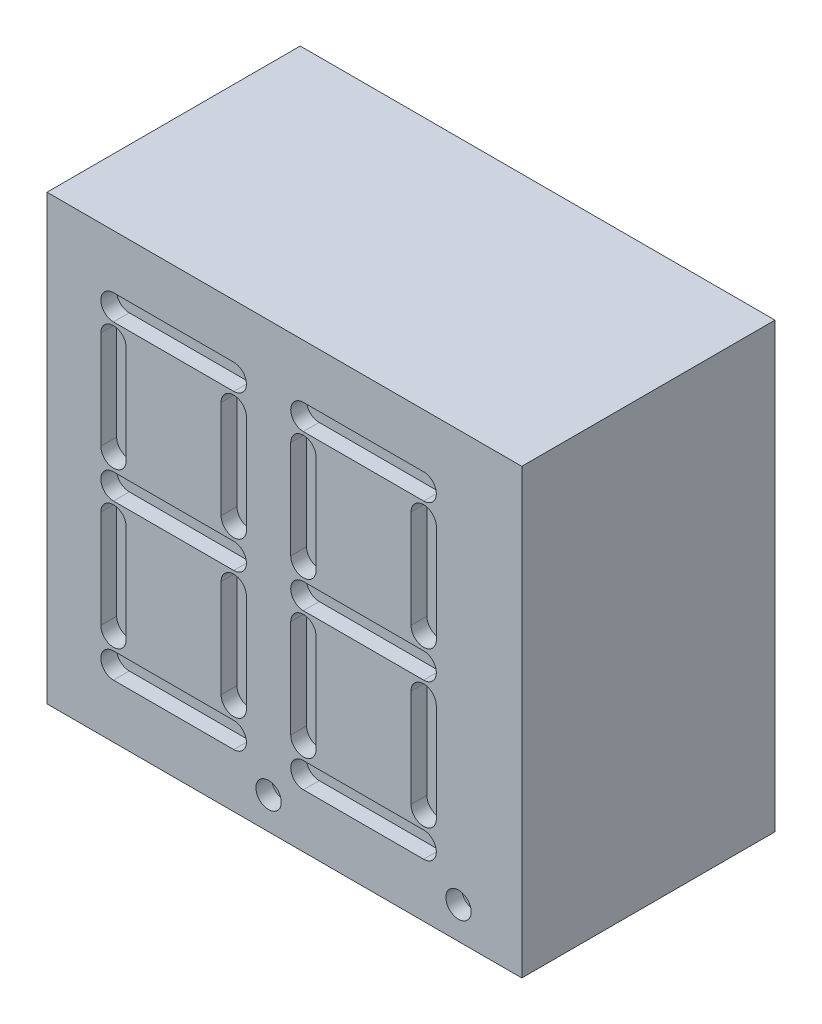
from build123d import *

# Parameters (mm, degrees)
SKETCH_1_W          = 15
SKETCH_1_H          = 14
EXTRUDE_1_DEPTH     = 8
SKETCH_2_R          = 0.4
CUT_EXTRUDE_1_DEPTH = 0.5


with BuildPart() as part:
    # 草图1 → 凸台-拉伸1 (new body)
    with BuildSketch(Plane.XY):
        Rectangle(SKETCH_1_W, SKETCH_1_H)
    extrude(amount=EXTRUDE_1_DEPTH)

    # 草图2 → 切除-拉伸1 (cut)
    with BuildSketch(Plane.XY.offset(8)):
        with Locations((-0.5, -5.99218047)):
            Circle(SKETCH_2_R)
        with Locations((5.5, -5.99218047)):
            Circle(SKETCH_2_R)
        with BuildLine():
            Line((-5.4, 5.3), (-1.6, 5.3))
            ThreePointArc((-1.6, 5.3), (-1.2, 4.9), (-1.6, 4.5))
            Line((-1.6, 4.5), (-5.4, 4.5))
            ThreePointArc((-5.4, 4.5), (-5.8, 4.9), (-5.4, 5.3))
        make_face()
        with BuildLine():
            Line((-5.4, -5.3), (-1.6, -5.3))
            ThreePointArc((-1.6, -5.3), (-1.2, -4.9), (-1.6, -4.5))
            Line((-1.6, -4.5), (-5.4, -4.5))
            ThreePointArc((-5.4, -4.5), (-5.8, -4.9), (-5.4, -5.3))
        make_face()
        with BuildLine():
            Line((-5.8, 4), (-5.8, 0.9))
            ThreePointArc((-5.8, 0.9), (-5.4, 0.5), (-5, 0.9))
            Line((-5, 0.9), (-5, 4))
            ThreePointArc((-5, 4), (-5.4, 4.4), (-5.8, 4))
        make_face()
        with BuildLine():
            Line((-2, 4), (-2, 0.9))
            ThreePointArc((-2, 0.9), (-1.6, 0.5), (-1.2, 0.9))
            Line((-1.2, 0.9), (-1.2, 4))
            ThreePointArc((-1.2, 4), (-1.6, 4.4), (-2, 4))
        make_face()
        with BuildLine():
            Line((-1.2, -4), (-1.2, -0.9))
            ThreePointArc((-1.2, -0.9), (-1.6, -0.5), (-2, -0.9))
            Line((-2, -0.9), (-2, -4))
            ThreePointArc((-2, -4), (-1.6, -4.4), (-1.2, -4))
        make_face()
        with BuildLine():
            Line((-5.8, -4), (-5.8, -0.9))
            ThreePointArc((-5.8, -0.9), (-5.4, -0.5), (-5, -0.9))
            Line((-5, -0.9), (-5, -4))
            ThreePointArc((-5, -4), (-5.4, -4.4), (-5.8, -4))
        make_face()
        with BuildLine():
            Line((-5.4, 0.4), (-1.6, 0.4))
            ThreePointArc((-1.6, 0.4), (-1.2, 0), (-1.6, -0.4))
            Line((-1.6, -0.4), (-5.4, -0.4))
            ThreePointArc((-5.4, -0.4), (-5.8, 0), (-5.4, 0.4))
        make_face()
        with BuildLine():
            Line((4.4, -5.3), (0.6, -5.3))
            ThreePointArc((0.6, -5.3), (0.2, -4.9), (0.6, -4.5))
            Line((0.6, -4.5), (4.4, -4.5))
            ThreePointArc((4.4, -4.5), (4.8, -4.9), (4.4, -5.3))
        make_face()
        with BuildLine():
            Line((0.2, -4), (0.2, -0.9))
            ThreePointArc((0.2, -0.9), (0.6, -0.5), (1, -0.9))
            Line((1, -0.9), (1, -4))
            ThreePointArc((1, -4), (0.6, -4.4), (0.2, -4))
        make_face()
        with BuildLine():
            Line((4, -4), (4, -0.9))
            ThreePointArc((4, -0.9), (4.4, -0.5), (4.8, -0.9))
            Line((4.8, -0.9), (4.8, -4))
            ThreePointArc((4.8, -4), (4.4, -4.4), (4, -4))
        make_face()
        with BuildLine():
            Line((4.4, -0.4), (0.6, -0.4))
            ThreePointArc((0.6, -0.4), (0.2, 0), (0.6, 0.4))
            Line((0.6, 0.4), (4.4, 0.4))
            ThreePointArc((4.4, 0.4), (4.8, 0), (4.4, -0.4))
        make_face()
        with BuildLine():
            Line((0.2, 4), (0.2, 0.9))
            ThreePointArc((0.2, 0.9), (0.6, 0.5), (1, 0.9))
            Line((1, 0.9), (1, 4))
            ThreePointArc((1, 4), (0.6, 4.4), (0.2, 4))
        make_face()
        with BuildLine():
            Line((4.4, 4.5), (0.6, 4.5))
            ThreePointArc((0.6, 4.5), (0.2, 4.9), (0.6, 5.3))
            Line((0.6, 5.3), (4.4, 5.3))
            ThreePointArc((4.4, 5.3), (4.8, 4.9), (4.4, 4.5))
        make_face()
        with BuildLine():
            Line((4, 4), (4, 0.9))
            ThreePointArc((4, 0.9), (4.4, 0.5), (4.8, 0.9))
            Line((4.8, 0.9), (4.8, 4))
            ThreePointArc((4.8, 4), (4.4, 4.4), (4, 4))
        make_face()
    extrude(amount=-CUT_EXTRUDE_1_DEPTH, mode=Mode.SUBTRACT)


solid = part.part
